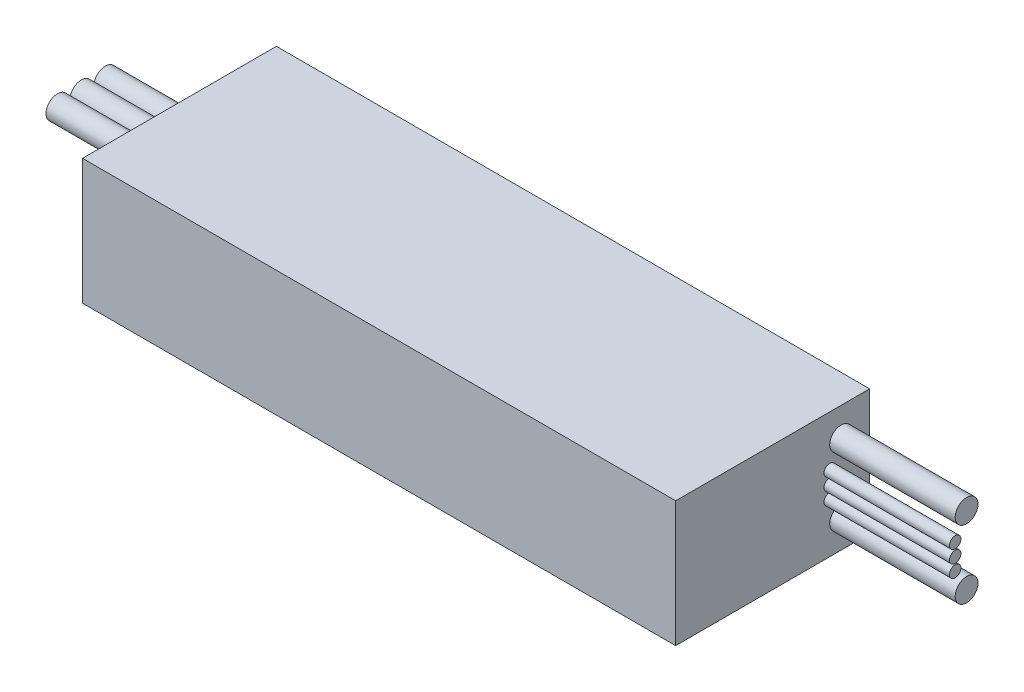
from build123d import *

# Parameters (mm, degrees)
SKETCH1_W           = 52
SKETCH1_H           = 17
BOSS_EXTRUDE1_DEPTH = 11
SKETCH2_R           = 1
BOSS_EXTRUDE2_DEPTH = 11
SKETCH3_R           = 1
SKETCH3_R_2         = 0.5
BOSS_EXTRUDE3_DEPTH = 11


with BuildPart() as part:
    # Sketch1 → Boss-Extrude1 (new body)
    with BuildSketch(Plane(origin=(0, 0, 0), x_dir=(1, 0, 0), z_dir=(0, 1, 0))):
        with Locations((26, 8.5)):
            Rectangle(SKETCH1_W, SKETCH1_H)
    extrude(amount=BOSS_EXTRUDE1_DEPTH)

    # Sketch2 → Boss-Extrude2 (add)
    with BuildSketch(Plane.ZY):
        with Locations(Location((-13, 5, 0), (0, 0, 180))):
            Circle(SKETCH2_R)
        with Locations(Location((-10.9, 5, 0), (0, 0, 180))):
            Circle(SKETCH2_R)
        with Locations(Location((-8.8, 5, 0), (0, 0, 180))):
            Circle(SKETCH2_R)
    extrude(amount=BOSS_EXTRUDE2_DEPTH)

    # Sketch3 → Boss-Extrude3 (add)
    with BuildSketch(Plane(origin=(52, 0, 0), x_dir=(0, 0, -1), z_dir=(1, 0, 0))):
        with Locations(Location((14.5, 8.5, 0), (0, 0, 180))):
            Circle(SKETCH3_R)
        with Locations(Location((14.5, 2.5, 0), (0, 0, 180))):
            Circle(SKETCH3_R)
        with Locations(Location((13.5, 6.6, 0), (0, 0, 180))):
            Circle(SKETCH3_R_2)
        with Locations(Location((13.5, 5.5, 0), (0, 0, 180))):
            Circle(SKETCH3_R_2)
        with Locations(Location((13.5, 4.4, 0), (0, 0, 180))):
            Circle(SKETCH3_R_2)
    extrude(amount=BOSS_EXTRUDE3_DEPTH)


solid = part.part
